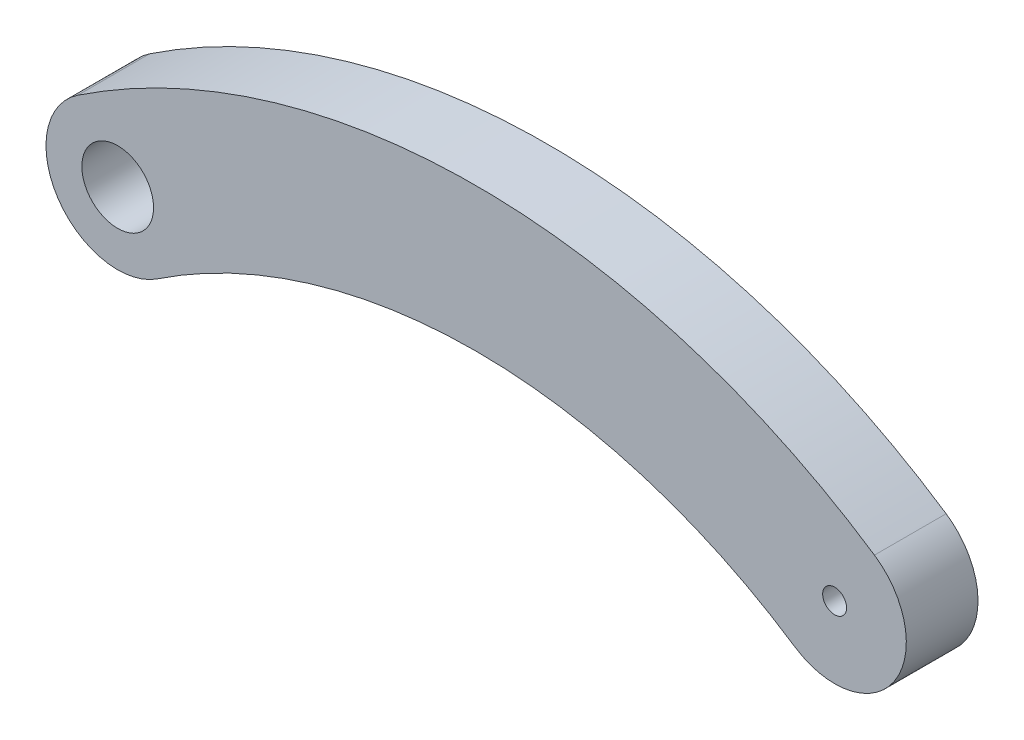
from build123d import *

# Parameters (mm, degrees)
SKETCH_1_R      = 1.5
EXTRUDE_1_DEPTH = 3
SKETCH_2_R      = 1.5
SKETCH_2_R_2    = 0.5
EXTRUDE_2_DEPTH = 3


with BuildPart() as part:
    # 草图1 → 凸台-拉伸1 (new body)
    with BuildSketch(Plane.XY):
        with BuildLine():
            ThreePointArc((31.666666667, 2.494438258), (15, 7.550055679), (-1.666666667, 2.494438258))
            ThreePointArc((-1.666666667, 2.494438258), (-2.494438258, -1.666666667), (1.666666667, -2.494438258))
            ThreePointArc((1.666666667, -2.494438258), (15, 1.550055679), (28.333333333, -2.494438258))
            ThreePointArc((28.333333333, -2.494438258), (32.494438258, -1.666666667), (31.666666667, 2.494438258))
        make_face()
        Circle(SKETCH_1_R, mode=Mode.SUBTRACT)
        with Locations((30, 0)):
            Circle(SKETCH_1_R, mode=Mode.SUBTRACT)
    extrude(amount=EXTRUDE_1_DEPTH)

    # 草图2 → 凸台-拉伸2 (add, through all)
    with BuildSketch(Plane.XY.offset(3)):
        with Locations((30, 0)):
            Circle(SKETCH_2_R)
        with Locations((30, 0)):
            Circle(SKETCH_2_R_2, mode=Mode.SUBTRACT)
    extrude(amount=-EXTRUDE_2_DEPTH)


solid = part.part
